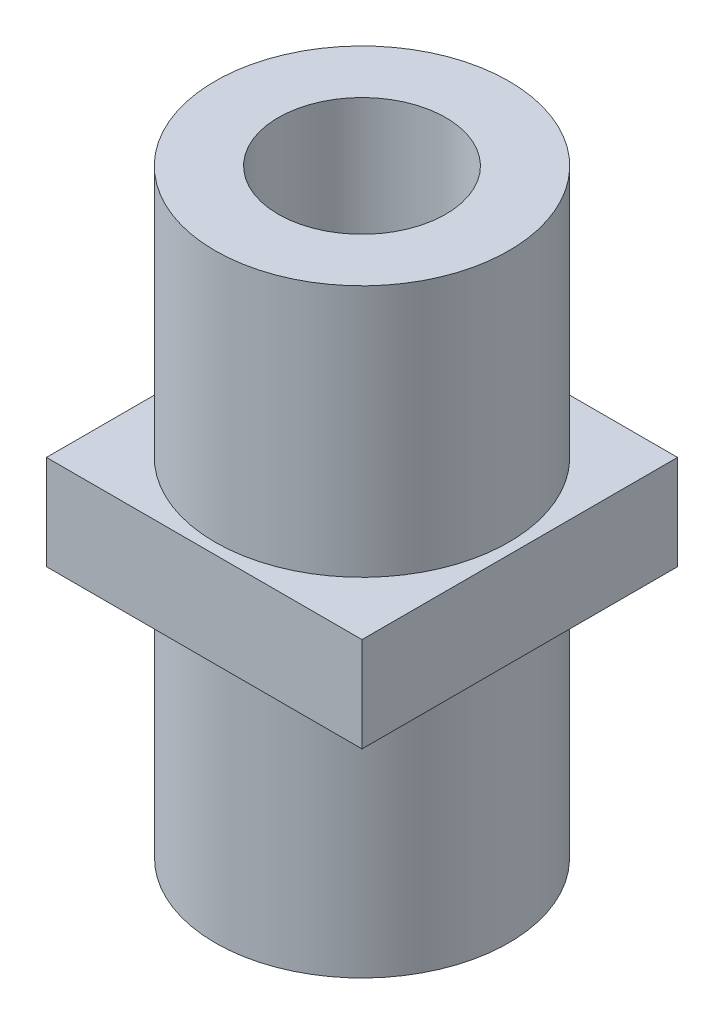
from build123d import *

# Parameters (mm, degrees)
SKETCH1_R               = 4.65
BOSS_EXTRUDE1_DEPTH     = 8
SKETCH2_W               = 10
SKETCH2_H               = 10
BOSS_EXTRUDE2_DEPTH     = 3
SKETCH3_R               = 4.655
BOSS_EXTRUDE3_DEPTH     = 8
CUT_EXTRUDE1_DEPTH      = 21.273134933
CUT_EXTRUDE1_DEPTH_BACK = 21.273134933
SKETCH4_R               = 2.655


with BuildPart() as part:
    # Sketch1 → Boss-Extrude1 (new body)
    with BuildSketch(Plane(origin=(0, 0, 0), x_dir=(1, 0, 0), z_dir=(0, 1, 0))):
        with Locations(Location((0, 0, 0), (0, 0, 270))):
            Circle(SKETCH1_R)
    extrude(amount=BOSS_EXTRUDE1_DEPTH)

    # Sketch2 → Boss-Extrude2 (add)
    with BuildSketch(Plane(origin=(0, 8, 0), x_dir=(1, 0, 0), z_dir=(0, 1, 0))):
        Rectangle(SKETCH2_W, SKETCH2_H)
    extrude(amount=BOSS_EXTRUDE2_DEPTH)

    # Sketch3 → Boss-Extrude3 (add)
    with BuildSketch(Plane(origin=(0, 11, 0), x_dir=(1, 0, 0), z_dir=(0, 1, 0))):
        with Locations(Location((0, 0, 0), (0, 0, 270))):
            Circle(SKETCH3_R)
    extrude(amount=BOSS_EXTRUDE3_DEPTH)

    # Sketch4 → Cut-Extrude1 (cut, two sides: drawn at the far end of the back side and taken through both)
    with BuildSketch(Plane(origin=(0, 19, 0), x_dir=(1, 0, 0), z_dir=(0, 1, 0)).offset(-CUT_EXTRUDE1_DEPTH_BACK)):
        with Locations(Location((0, 0, 0), (0, 0, 270))):
            Circle(SKETCH4_R)
    extrude(amount=CUT_EXTRUDE1_DEPTH + CUT_EXTRUDE1_DEPTH_BACK, mode=Mode.SUBTRACT)


solid = part.part
